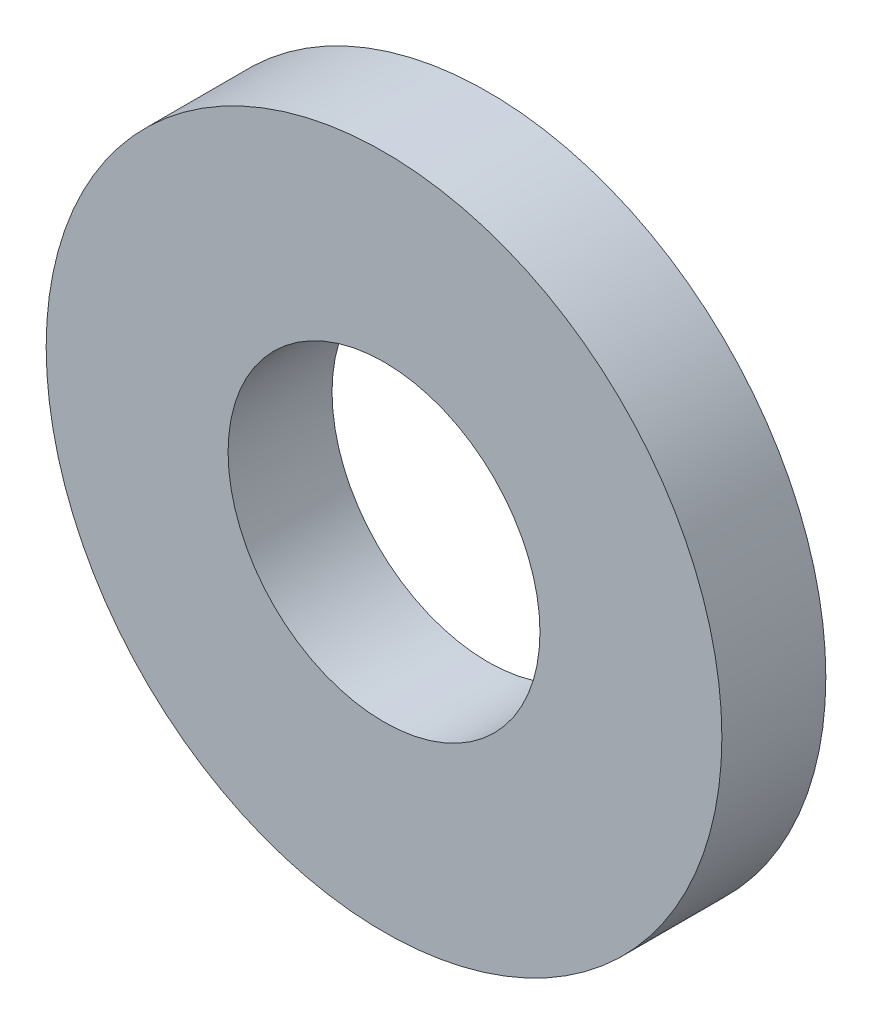
from build123d import *

# Parameters (mm, degrees)
SKETCH_1_R      = 13
SKETCH_1_R_2    = 6
EXTRUDE_1_DEPTH = 4


with BuildPart() as part:
    # 草图1 → 凸台-拉伸1 (new body)
    with BuildSketch(Plane.XY):
        Circle(SKETCH_1_R)
        Circle(SKETCH_1_R_2, mode=Mode.SUBTRACT)
    extrude(amount=EXTRUDE_1_DEPTH)


solid = part.part
